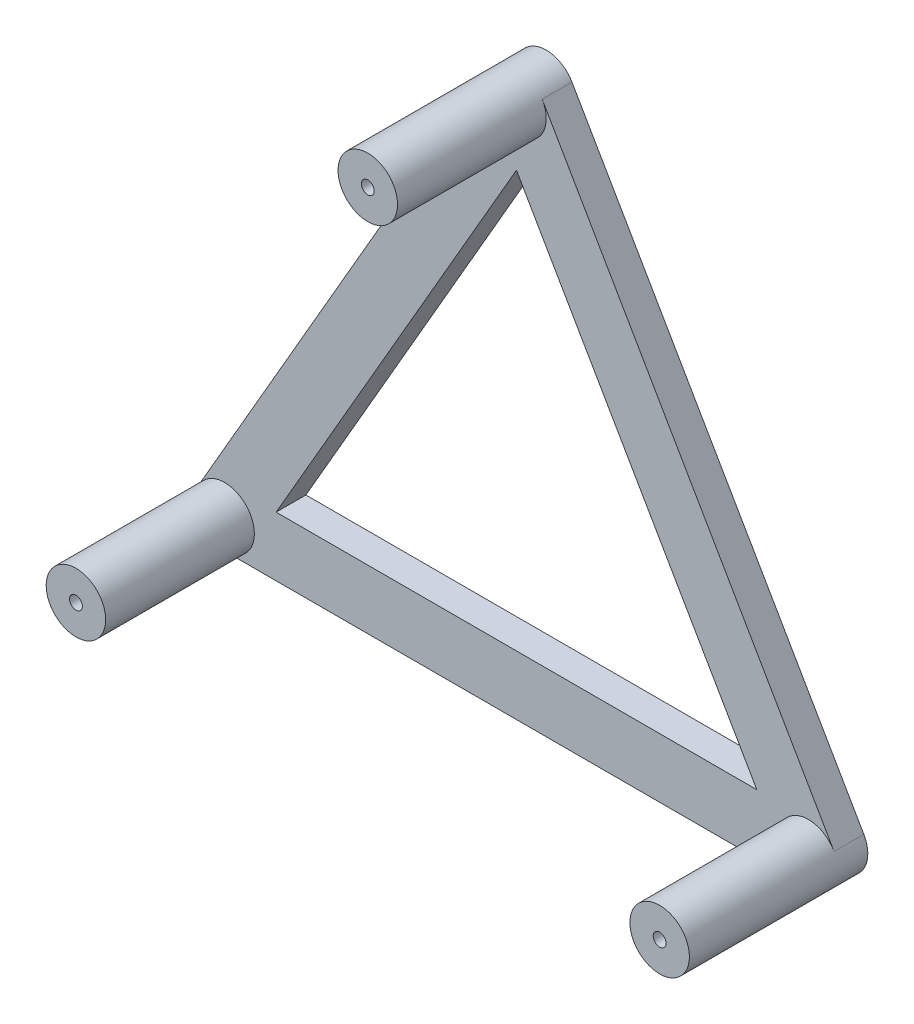
from build123d import *

# Parameters (mm, degrees)
EXTRUDE_1_DEPTH     = 3
EXTRUDE_START       = 3
SKETCH_1_6_R        = 3
EXTRUDE_2_DEPTH     = 15
CUT_EXTRUDE_START   = 18
SKETCH_1_7_R        = 0.65
CUT_EXTRUDE_2_DEPTH = 2
SKETCH_2_R          = 0.75
CUT_EXTRUDE_3_DEPTH = 2


with BuildPart() as part:
    # 草图1 → 凸台-拉伸1 (new body)
    with BuildSketch(Plane.XY):
        with BuildLine():
            Line((-29.444863729, -20), (29.444863729, -20))
            ThreePointArc((29.444863729, -20), (32.04293994, -18.5), (32.04293994, -15.5))
            Line((32.04293994, -15.5), (2.598076211, 35.5))
            ThreePointArc((2.598076211, 35.5), (0, 37), (-2.598076211, 35.5))
            Line((-2.598076211, 35.5), (-32.04293994, -15.5))
            ThreePointArc((-32.04293994, -15.5), (-32.04293994, -18.5), (-29.444863729, -20))
        make_face()
        Polygon((24.248711306, -14), (-24.248711306, -14), (0, 28), align=None, mode=Mode.SUBTRACT)
    extrude(amount=EXTRUDE_1_DEPTH)

    # 草图1<6> → 凸台-拉伸2 (add)
    with BuildSketch(Plane.XY.offset(EXTRUDE_START)):
        with Locations(Location((-29.444863729, -17, 0), (0, 0, 150))):
            Circle(SKETCH_1_6_R)
        with Locations(Location((29.444863729, -17, 0), (0, 0, 270))):
            Circle(SKETCH_1_6_R)
        with Locations(Location((0, 34, 0), (0, 0, 150))):
            Circle(SKETCH_1_6_R)
    extrude(amount=EXTRUDE_2_DEPTH)

    # 草图1<7> → 切除-拉伸2 (cut)
    with BuildSketch(Plane.XY.offset(CUT_EXTRUDE_START)):
        with Locations((0, 34)):
            Circle(SKETCH_1_7_R)
        with Locations((-29.444863729, -17)):
            Circle(SKETCH_1_7_R)
        with Locations((29.444863729, -17)):
            Circle(SKETCH_1_7_R)
    extrude(amount=-CUT_EXTRUDE_2_DEPTH, mode=Mode.SUBTRACT)

    # 草图2 → 切除-拉伸3 (cut)
    with BuildSketch(Plane(origin=(0, 0, 0), x_dir=(-1, 0, 0), z_dir=(0, 0, -1))):
        with Locations((-13.665408814, -17)):
            Circle(SKETCH_2_R)
        with Locations((13.665408814, -17)):
            Circle(SKETCH_2_R)
        with Locations((0, 34)):
            Circle(SKETCH_2_R)
    extrude(amount=-CUT_EXTRUDE_3_DEPTH, mode=Mode.SUBTRACT)


solid = part.part
